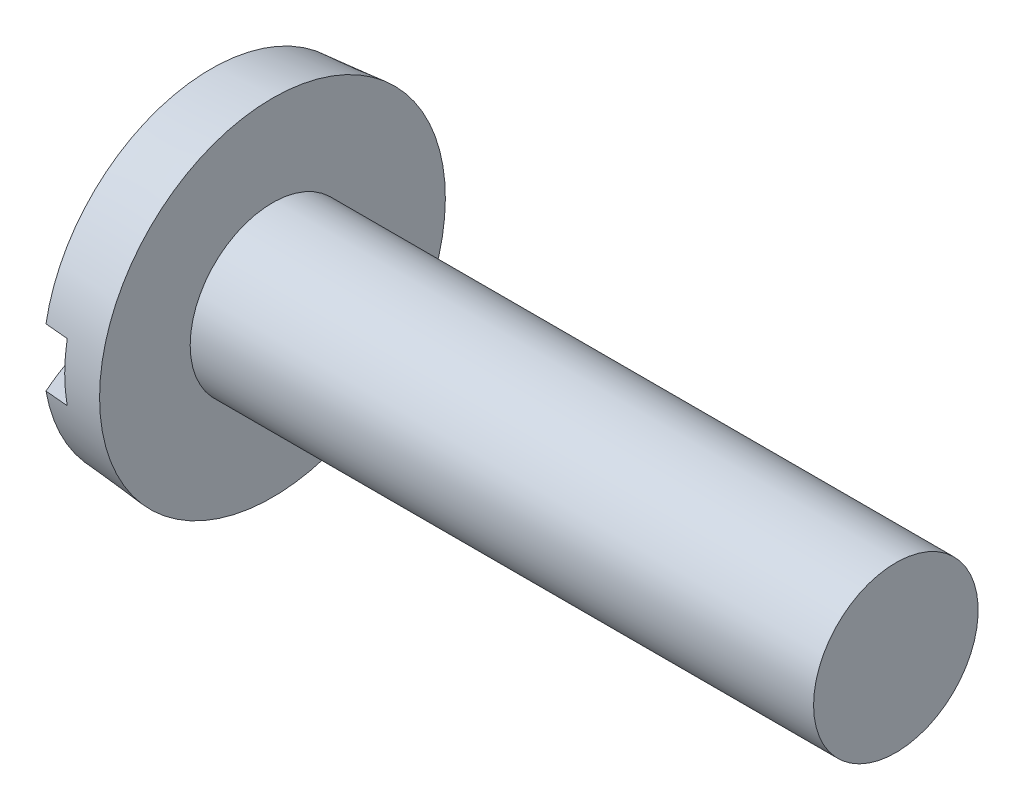
from build123d import *

# Parameters (mm, degrees)
SKETCH2_W  = 5.2832
SKETCH2_H  = 0.889
SLOT_DEPTH = 0.9144


with BuildPart() as part:
    # BodySke → Base-Revolve (revolve)
    with BuildSketch(Plane.XY, mode=Mode.PRIVATE) as base_revolve_sk:
        with BuildLine():
            Line((1.4986, 1.2573), (1.4986, 2.6416))
            Line((1.4986, 2.6416), (0.5588, 2.559378154))
            ThreePointArc((0.5588, 2.559378154), (0.141326332, 1.309835293), (0, 0))
            Line((0, 0), (11.0236, 0))
            Line((11.0236, 0), (11.0236, 1.2573))
            Line((11.0236, 1.2573), (1.4986, 1.2573))
        make_face()
    revolve(base_revolve_sk.sketch.rotate(Axis((-25.4, 0, 0), (1, 0, 0)), 90), axis=Axis((-25.4, 0, 0), (1, 0, 0)))

    # Sketch2 → Slot (cut)
    with BuildSketch(Plane(origin=(0, 0, 0), x_dir=(0, 0, -1), z_dir=(1, 0, 0))):
        Rectangle(SKETCH2_W, SKETCH2_H)
    extrude(amount=SLOT_DEPTH, mode=Mode.SUBTRACT)


solid = part.part
